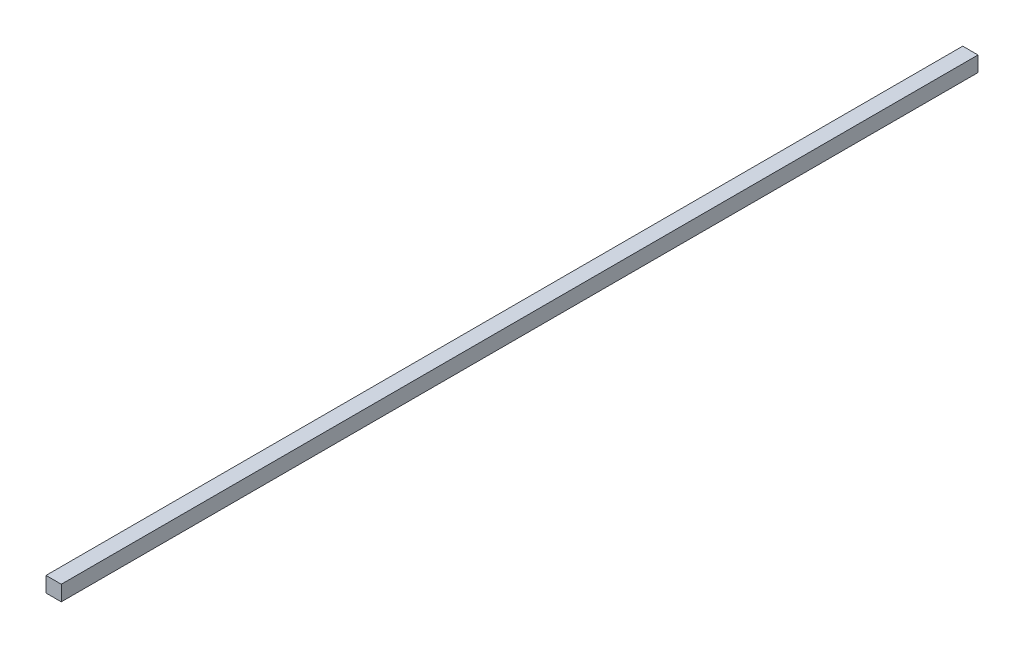
from build123d import *

# Parameters (mm, degrees)
SKETCH1_W           = 10
SKETCH1_H           = 10
BOSS_EXTRUDE1_DEPTH = 600


with BuildPart() as part:
    # Sketch1 → Boss-Extrude1 (new body)
    with BuildSketch(Plane.XY):
        with Locations((5, -5)):
            Rectangle(SKETCH1_W, SKETCH1_H)
    extrude(amount=BOSS_EXTRUDE1_DEPTH)


solid = part.part
